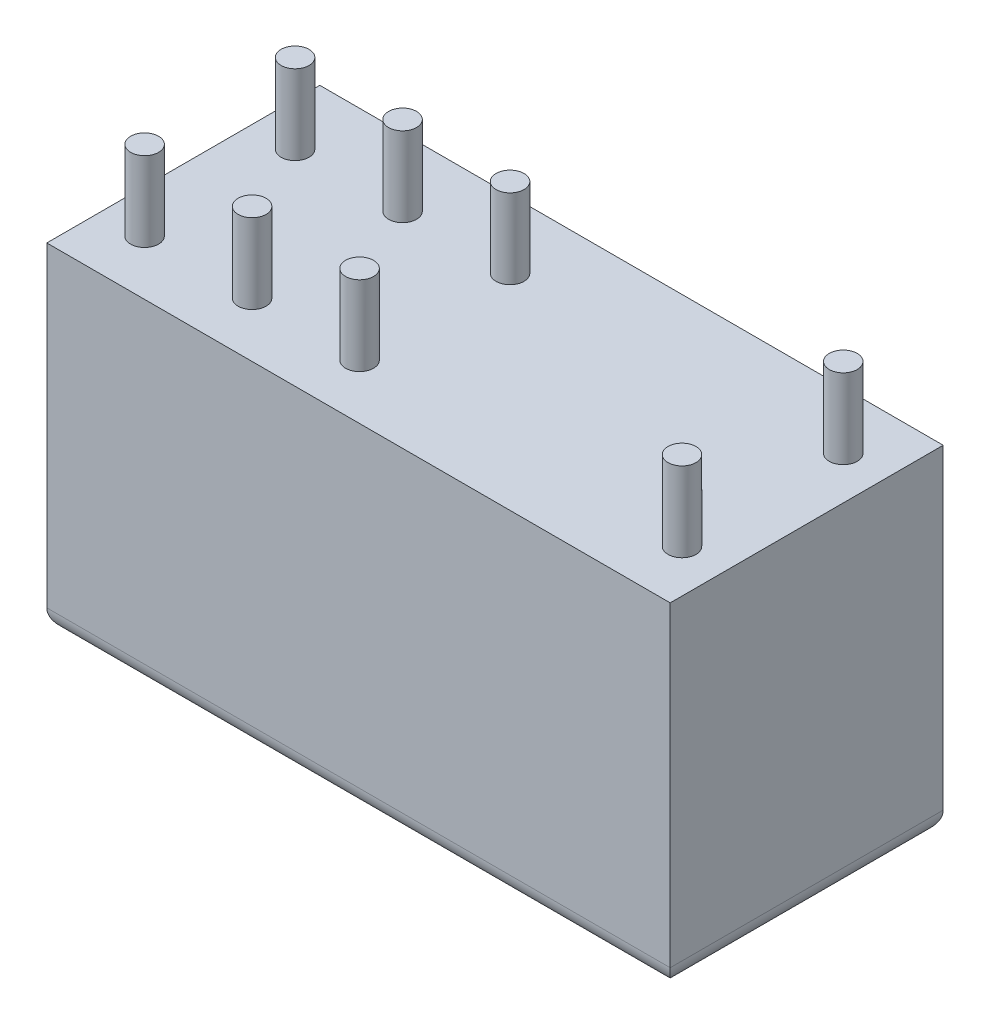
from build123d import *

# Parameters (mm, degrees)
SKETCH1_W           = 29
SKETCH1_H           = 12.7
BOSS_EXTRUDE1_DEPTH = 15.7
SKETCH2_R           = 0.65
BOSS_EXTRUDE2_DEPTH = 3.7
FILLET1_R           = 1


with BuildPart() as part:
    # Sketch1 → Boss-Extrude1 (new body)
    with BuildSketch(Plane(origin=(0, 0, 0), x_dir=(1, 0, 0), z_dir=(0, 1, 0))):
        Rectangle(SKETCH1_W, SKETCH1_H)
    extrude(amount=BOSS_EXTRUDE1_DEPTH)

    # Sketch2 → Boss-Extrude2 (add)
    with BuildSketch(Plane(origin=(0, 15.7, 0), x_dir=(1, 0, 0), z_dir=(0, 1, 0))):
        with Locations(Location((12.5, -3.8, 0), (0, 0, 90))):
            Circle(SKETCH2_R)
        with Locations(Location((-12.5, -3.8, 0), (0, 0, 90))):
            Circle(SKETCH2_R)
        with Locations(Location((-7.5, 3.2, 0), (0, 0, 90))):
            Circle(SKETCH2_R)
        with Locations(Location((-2.5, -3.8, 0), (0, 0, 90))):
            Circle(SKETCH2_R)
        with Locations(Location((12.5, 3.7, 0), (0, 0, 90))):
            Circle(SKETCH2_R)
        with Locations(Location((-2.5, 3.2, 0), (0, 0, 90))):
            Circle(SKETCH2_R)
        with Locations(Location((-7.5, -3.8, 0), (0, 0, 90))):
            Circle(SKETCH2_R)
        with Locations(Location((-12.5, 3.2, 0), (0, 0, 90))):
            Circle(SKETCH2_R)
    extrude(amount=BOSS_EXTRUDE2_DEPTH)

    # Fillet1
    fillet1_edges = [part.edges().sort_by_distance(p)[0] for p in [
        (0, 0, 6.35),
        (-14.5, 0, 0),
        (0, 0, -6.35),
        (14.5, 0, 0),
    ]]
    fillet(fillet1_edges, radius=FILLET1_R)


solid = part.part
